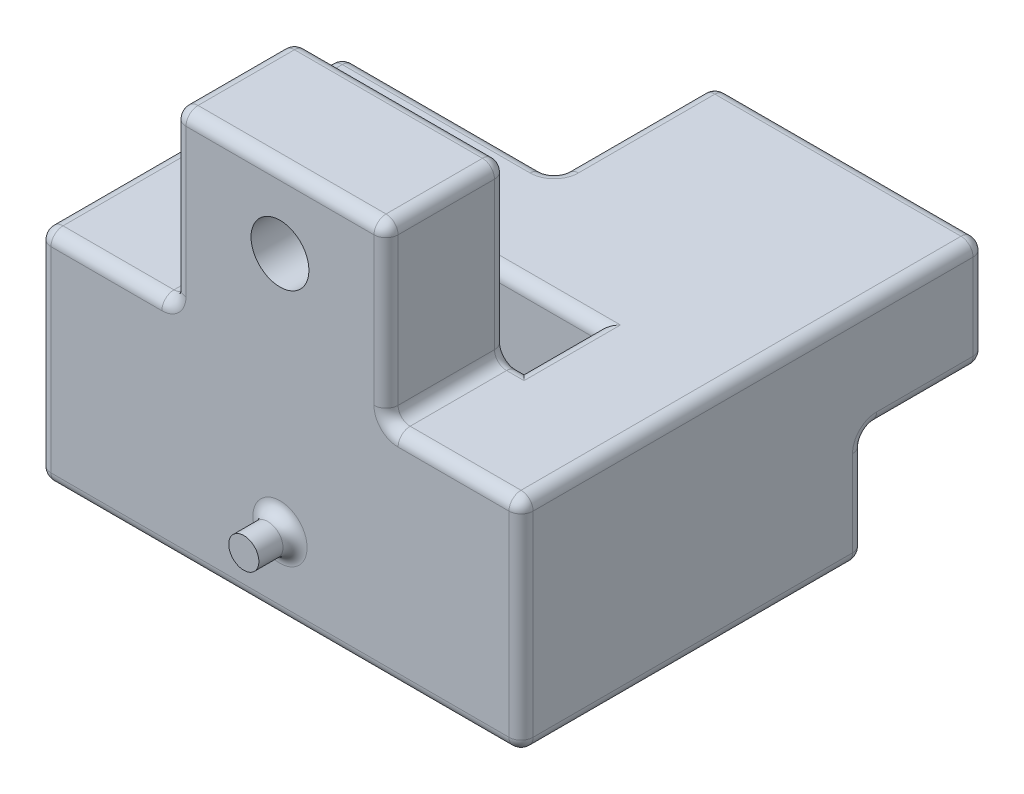
from build123d import *

# Parameters (mm, degrees)
SKETCH1_W            = 40
SKETCH1_H            = 38.5
SKETCH1_R            = 2.1
SKETCH1_W_2          = 20.5
SKETCH1_H_2          = 6
BOSS_EXTRUDE1_DEPTH  = 18.25
SKETCH2_W            = 17.597378004
SKETCH2_H            = 28.5
SKETCH2_R            = 1.25
SKETCH2_R_2          = 0.693041975
BOSS_EXTRUDE2_DEPTH  = 10
SKETCH3_R            = 1.25
BOSS_EXTRUDE3_DEPTH  = 3
SKETCH4_R            = 1.25
BOSS_EXTRUDE4_DEPTH  = 3
SKETCH5_W            = 17.581286621
SKETCH5_H            = 13.329879295
CUT_EXTRUDE1_DEPTH   = 15.24
CHAMFER1_SIZE        = 10
SKETCH6_W            = 16.884369207
SKETCH6_H            = 10
CUT_EXTRUDE2_DEPTH   = 9.125
FILLET1_R            = 1
M4_CLEARANCE_HOLE1_D = 4.8


with BuildPart() as part:
    # Sketch1 → Boss-Extrude1 (new body)
    with BuildSketch(Plane(origin=(0, 0, 0), x_dir=(1, 0, 0), z_dir=(0, 1, 0))):
        with Locations((0, 6.25)):
            Rectangle(SKETCH1_W, SKETCH1_H)
        with Locations(Location((-9.6, 17.5, 0), (0, 0, 270))):
            Circle(SKETCH1_R, mode=Mode.SUBTRACT)
        Rectangle(SKETCH1_W_2, SKETCH1_H_2, mode=Mode.SUBTRACT)
    extrude(amount=BOSS_EXTRUDE1_DEPTH)

    # Sketch2 → Boss-Extrude2 (add)
    with BuildSketch(Plane.XY.offset(13)):
        with Locations((0, 18.25)):
            Rectangle(SKETCH2_W, SKETCH2_H)
        with Locations((0, 6.25)):
            Circle(SKETCH2_R, mode=Mode.SUBTRACT)
        with Locations((0, 26.25)):
            Circle(SKETCH2_R_2, mode=Mode.SUBTRACT)
    extrude(amount=-BOSS_EXTRUDE2_DEPTH)

    # Sketch3 → Boss-Extrude3 (add)
    with BuildSketch(Plane.XY.offset(13)):
        with Locations(Location((0, 6.25, 0), (0, 0, 180))):
            Circle(SKETCH3_R)
    extrude(amount=BOSS_EXTRUDE3_DEPTH)

    # Sketch4 → Boss-Extrude4 (add)
    with BuildSketch(Plane.XZ):
        with Locations(Location((0, 8, 0), (0, 0, 270))):
            Circle(SKETCH4_R)
    extrude(amount=BOSS_EXTRUDE4_DEPTH)

    # Sketch5 → Cut-Extrude1 (cut)
    with BuildSketch(Plane(origin=(0, 18.25, 0), x_dir=(1, 0, 0), z_dir=(0, 1, 0))):
        with Locations((-11.209356689, 18.835060353)):
            Rectangle(SKETCH5_W, SKETCH5_H)
    extrude(amount=-CUT_EXTRUDE1_DEPTH, mode=Mode.SUBTRACT)

    # Chamfer1
    chamfer1_edges = [part.edges().sort_by_distance(p)[0] for p in [
        (-20, 1.505, -25.5),
    ]]
    chamfer(chamfer1_edges, length=CHAMFER1_SIZE)

    # Sketch6 → Cut-Extrude2 (cut)
    with BuildSketch(Plane.XZ):
        with Locations((11.557815397, -20.5)):
            Rectangle(SKETCH6_W, SKETCH6_H)
    extrude(amount=-CUT_EXTRUDE2_DEPTH, mode=Mode.SUBTRACT)

    # Fillet1
    fillet1_edges = [part.edges().sort_by_distance(p)[0] for p in [
        (-3.442184603, 0, -25.5),
        (20, 9.125, -20.5),
        (20, 4.5625, -15.5),
        (11.557815397, 9.125, -25.5),
        (3.115630793, 4.5625, -25.5),
        (11.557815397, 9.125, -15.5),
        (3.115630793, 4.5625, -15.5),
        (11.557815397, 0, -15.5),
        (3.115630793, 0, -20.5),
        (20, 18.25, -6.25),
        (10.25, 0, 0),
        (0, 0, -3),
        (-10.25, 0, 0),
        (0, 0, 3),
        (10.25, 18.25, 0),
        (8.79064331, 18.25, -25.5),
        (0, 18.25, -3),
        (-10.25, 18.25, 0),
        (-9.524344501, 18.25, 3),
        (9.524344501, 18.25, 3),
        (14.399344501, 18.25, 13),
        (-8.798689002, 25.375, 13),
        (8.798689002, 25.375, 13),
        (0, 32.5, 13),
        (8.798689002, 25.375, 3),
        (8.798689002, 32.5, 8),
        (-8.798689002, 25.375, 3),
        (8.798689002, 18.25, 8),
        (-8.798689002, 18.25, 8),
        (0, 32.5, 3),
        (-8.798689002, 32.5, 8),
        (-0.693041975, 26.25, 13),
        (20, 0, -1.25),
        (1.25, 6.25, 13),
        (0, 0, 13),
        (20, 13.6875, -25.5),
        (20, 9.125, 13),
        (-20, 9.125, 13),
        (-20, 18.25, 0.414939647),
        (-20, 10.63, -12.170120705),
        (-6.20935669, 3.01, -25.5),
        (-2.418713379, 3.01, -18.835060353),
        (-2.418713379, 10.63, -25.5),
        (-11.20935669, 3.01, -12.170120705),
        (-2.418713379, 10.63, -12.170120705),
        (-11.20935669, 18.25, -12.170120705),
        (-2.418713379, 18.25, -18.835060353),
        (-14.399344501, 18.25, 13),
        (-20, 3.01, -13.835060353),
        (-20, 0, -1.25),
        (-20, 1.505, -15.5),
        (-15, 0, -20.5),
        (-10, 1.505, -25.5),
        (-15, 3.01, -20.5),
    ]]
    fillet(fillet1_edges, radius=FILLET1_R)

    # M4 Clearance Hole1 (through all)
    with Locations(Plane(origin=(0, 0, 3), x_dir=(-1, 0, 0), z_dir=(0, 0, -1))):
        with Locations((0, 26.25)):
            Hole(M4_CLEARANCE_HOLE1_D / 2)


solid = part.part
